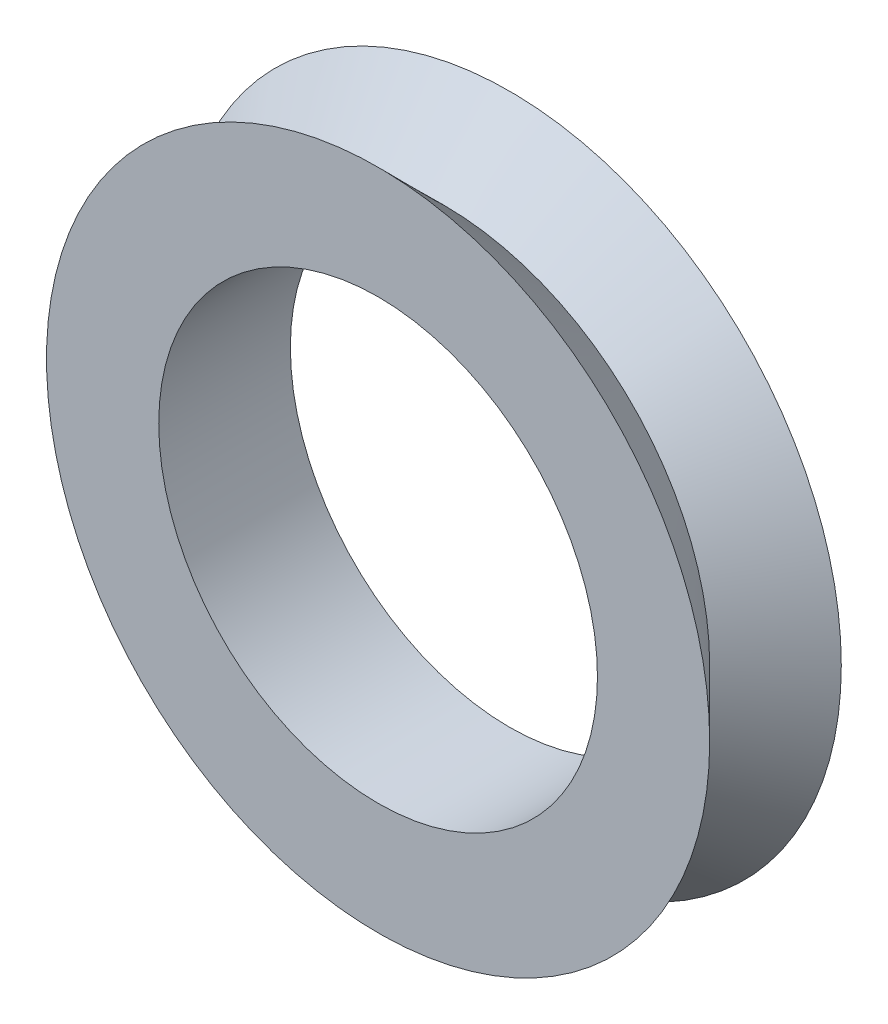
from build123d import *


with BuildPart() as part:
    # Sketch1 → Revolve1 (revolve)
    with BuildSketch(Plane(origin=(0, 0, 0), x_dir=(1, 0, 0), z_dir=(0, 1, 0))):
        Polygon((-15, -4.5), (-15, 4.5), (-22.675, 4.5), (-18.175, 0), (-22.675, -4.5), align=None)
    revolve(axis=Axis((0, 0, -6.580077143), (0, 0, -1)))


solid = part.part
